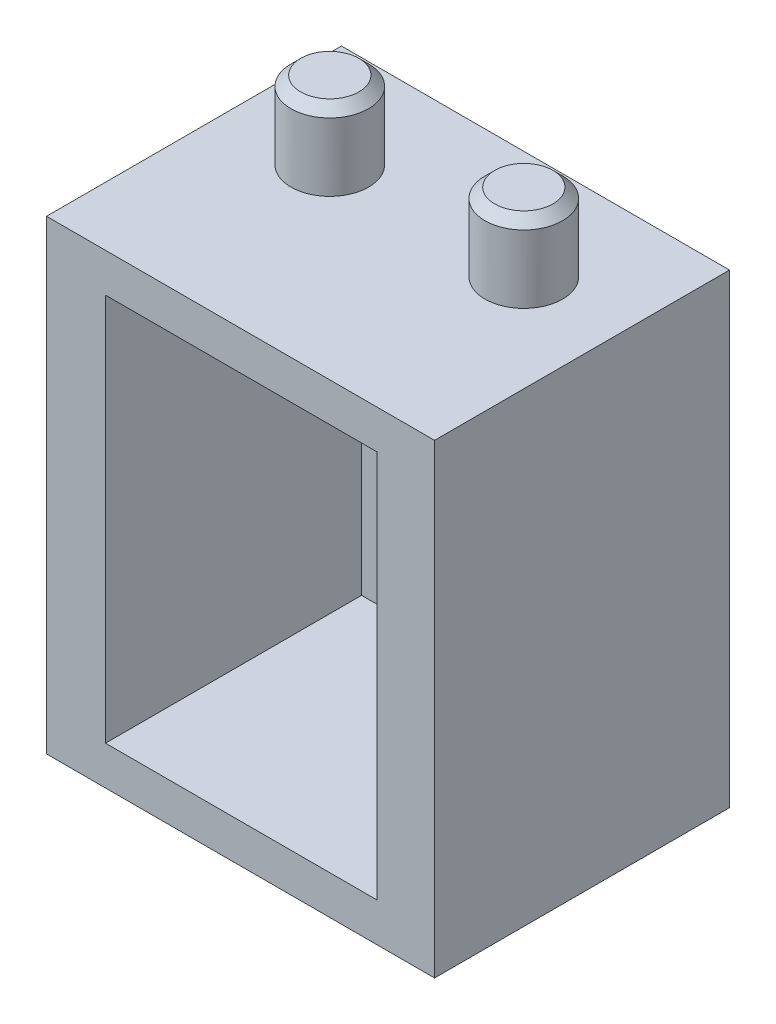
from build123d import *

# Parameters (mm, degrees)
SKETCH2_W               = 63.5
SKETCH2_H               = 76.2
BOSS_EXTRUDE1_DEPTH     = 48.26
SKETCH3_W               = 44.45
SKETCH3_H               = 63.5
CUT_EXTRUDE1_DEPTH      = 41.91
CUT_EXTRUDE2_DEPTH      = 108.680722973
CUT_EXTRUDE2_DEPTH_BACK = 108.680722973
SKETCH4_W               = 12.7
SKETCH4_H               = 6.35
SKETCH5_R               = 6.35
BOSS_EXTRUDE2_DEPTH     = 12.7
CHAMFER1_SIZE           = 1.5875


with BuildPart() as part:
    # Sketch2 → Boss-Extrude1 (new body)
    with BuildSketch(Plane.XY):
        with Locations((31.75, 38.1)):
            Rectangle(SKETCH2_W, SKETCH2_H)
    extrude(amount=BOSS_EXTRUDE1_DEPTH)

    # Sketch3 → Cut-Extrude1 (cut)
    with BuildSketch(Plane.XY.offset(48.26)):
        with Locations((31.877, 38.1)):
            Rectangle(SKETCH3_W, SKETCH3_H)
    extrude(amount=-CUT_EXTRUDE1_DEPTH, mode=Mode.SUBTRACT)

    # Sketch4 → Cut-Extrude2 (cut, two sides: drawn at the far end of the back side and taken through both)
    with BuildSketch(Plane.XY.offset(6.35).offset(-CUT_EXTRUDE2_DEPTH_BACK)):
        with Locations((31.877, 9.525)):
            Rectangle(SKETCH4_W, SKETCH4_H)
        with BuildLine():
            Line((18.2626, 64.1985), (18.2626, 12.0015))
            ThreePointArc((18.2626, 12.0015), (16.383, 10.1219), (14.5034, 12.0015))
            Line((14.5034, 12.0015), (14.5034, 64.1985))
            ThreePointArc((14.5034, 64.1985), (16.383, 66.0781), (18.2626, 64.1985))
        make_face()
        with BuildLine():
            Line((49.2506, 64.1985), (49.2506, 12.0015))
            ThreePointArc((49.2506, 12.0015), (47.371, 10.1219), (45.4914, 12.0015))
            Line((45.4914, 12.0015), (45.4914, 64.1985))
            ThreePointArc((45.4914, 64.1985), (47.371, 66.0781), (49.2506, 64.1985))
        make_face()
    extrude(amount=CUT_EXTRUDE2_DEPTH + CUT_EXTRUDE2_DEPTH_BACK, mode=Mode.SUBTRACT)

    # Sketch5 → Boss-Extrude2 (add)
    with BuildSketch(Plane(origin=(0, 76.2, 0), x_dir=(1, 0, 0), z_dir=(0, 1, 0))):
        with Locations(Location((15.875, -17.78, 0), (0, 0, 90))):
            Circle(SKETCH5_R)
        with Locations(Location((47.625, -17.78, 0), (0, 0, 90))):
            Circle(SKETCH5_R)
    extrude(amount=BOSS_EXTRUDE2_DEPTH)

    # Chamfer1
    chamfer1_edges = [part.edges().sort_by_distance(p)[0] for p in [
        (15.875, 88.9, 24.13),
        (47.625, 88.9, 24.13),
    ]]
    chamfer(chamfer1_edges, length=CHAMFER1_SIZE)


solid = part.part
